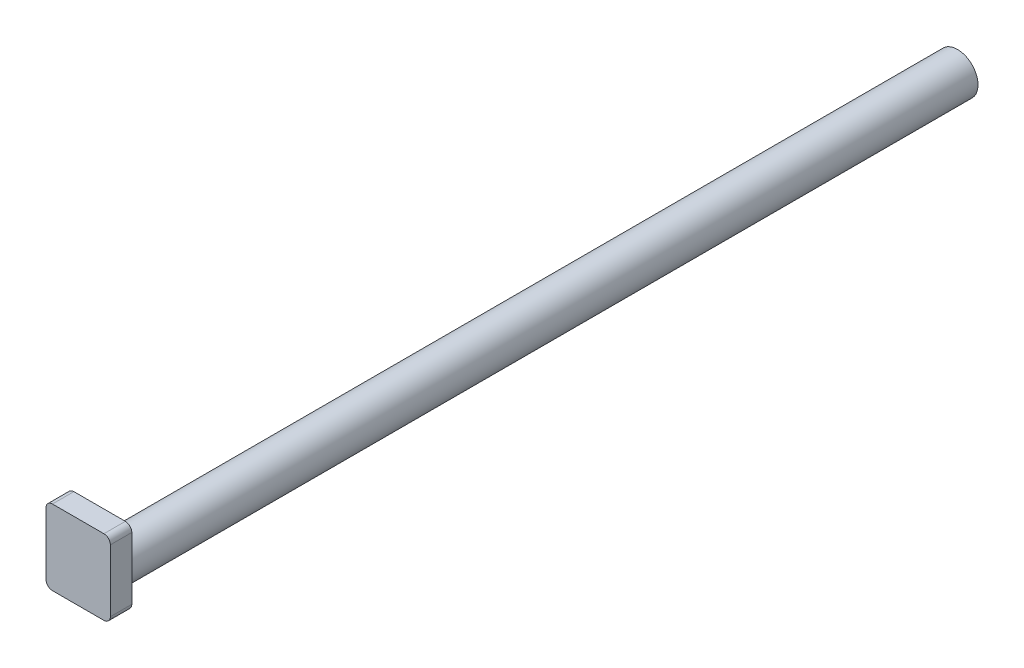
from build123d import *

# Parameters (mm, degrees)
SKETCH1_R           = 9.525
BOSS_EXTRUDE1_DEPTH = 400
SKETCH2_W           = 30
SKETCH2_H           = 35
BOSS_EXTRUDE2_DEPTH = 10
FILLET1_R           = 3


with BuildPart() as part:
    # Sketch1 → Boss-Extrude1 (new body)
    with BuildSketch(Plane.XY):
        Circle(SKETCH1_R)
    extrude(amount=BOSS_EXTRUDE1_DEPTH)

    # Sketch2 → Boss-Extrude2 (add)
    with BuildSketch(Plane.XY.offset(400)):
        with Locations((0, 7.5)):
            Rectangle(SKETCH2_W, SKETCH2_H)
    extrude(amount=BOSS_EXTRUDE2_DEPTH)

    # Fillet1
    fillet1_edges = [part.edges().sort_by_distance(p)[0] for p in [
        (-15, 25, 405),
        (-15, -10, 405),
        (15, -10, 405),
        (15, 25, 405),
    ]]
    fillet(fillet1_edges, radius=FILLET1_R)


solid = part.part
